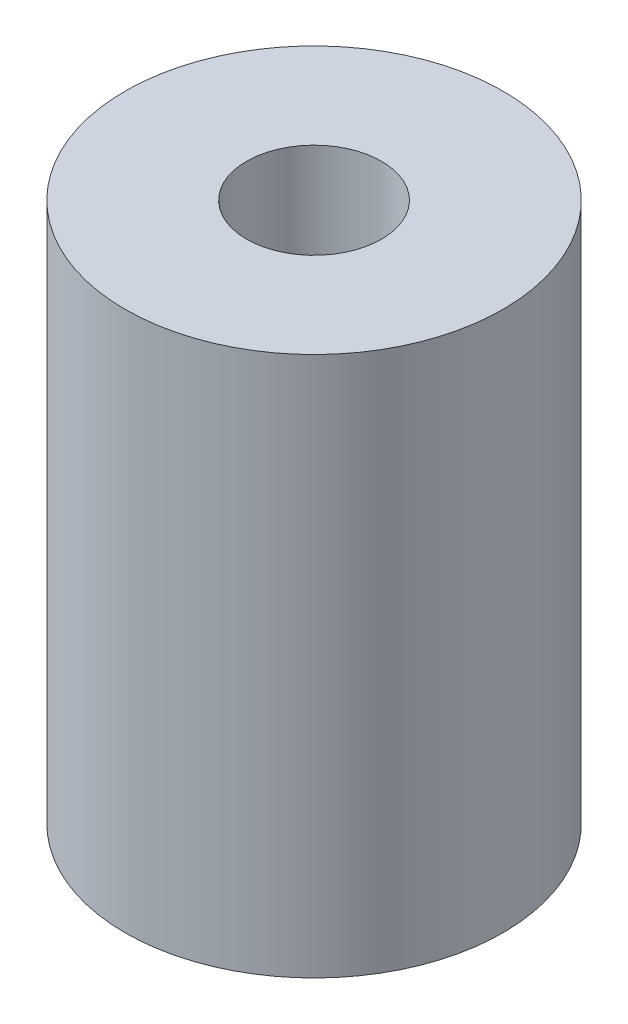
from build123d import *

# Parameters (mm, degrees)
SKETCH1_R           = 3.5
SKETCH1_R_2         = 1
BOSS_EXTRUDE1_DEPTH = 5
M3_TAPPED_HOLE1_D   = 2.5


with BuildPart() as part:
    # Sketch1 → Boss-Extrude1 (new, symmetric)
    with BuildSketch(Plane(origin=(0, 0, 0), x_dir=(1, 0, 0), z_dir=(0, 1, 0))):
        with Locations(Location((0, 0, 0), (0, 0, 270))):
            Circle(SKETCH1_R)
        with Locations(Location((0, 0, 0), (0, 0, 270))):
            Circle(SKETCH1_R_2, mode=Mode.SUBTRACT)
    extrude(amount=BOSS_EXTRUDE1_DEPTH, both=True)

    # M3 Tapped Hole1 (through all)
    with Locations(Plane(origin=(0, 5, 0), x_dir=(1, 0, 0), z_dir=(0, 1, 0))):
        with Locations((0, 0)):
            Hole(M3_TAPPED_HOLE1_D / 2)


solid = part.part
